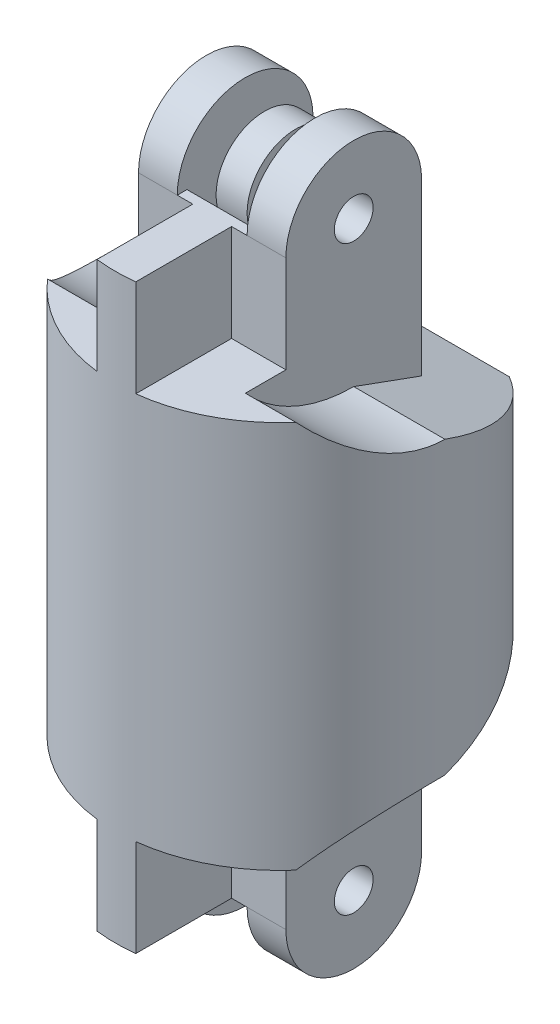
from build123d import *

# Parameters (mm, degrees)
SKETCH1_W                                 = 8.5
SKETCH1_H                                 = 10
INNER_START                               = 1.8
SKETCH2_R                                 = 1
INNER_HINGE_RIGHT_DEPTH                   = 2
SPRING_SEAT_REACH                         = 24.816
ROUNDED_START                             = -3.8
SKETCH4_R                                 = 7.5
ROUNDED_CUT_FOR_DISTAL_SEGMENT_LEFT_DEPTH = 19.262411473
SKETCH5_R                                 = 2.5
SPRING_DEPTH                              = 0.8
SPRING_WIRE_SLOT_DEPTH                    = 11
ANGLED_CUT_ROTATION_DEPTH                 = 24.786340706
CUT_EXTRUDE4_DEPTH                        = 23.06241155
CUT_EXTRUDE4_DEPTH_BACK                   = 23.06241155
STOPPER_START                             = 5
STOPPER_DEPTH                             = 5
DIGIT_FRONT_CONTOUR_DEPTH                 = 23.06241155
DIGIT_FRONT_CONTOUR_DEPTH_BACK            = 23.06241155
SKETCH10_W                                = 9.64365076
SKETCH10_H                                = 1.5
SKETCH11_R                                = 1.1
CUT_EXTRUDE5_DEPTH                        = 31.931375711


with BuildPart() as part:
    # Sketch1 → segment body (revolve)
    with BuildSketch(Plane.XY):
        with Locations((4.25, 5)):
            Rectangle(SKETCH1_W, SKETCH1_H)
    revolve(axis=Axis((0, 43.434679949, 0), (0, -1, 0)))

    # Sketch2 → inner hinge right (add)
    with BuildSketch(Plane(origin=(0, 0, 0), x_dir=(0, 0, -1), z_dir=(1, 0, 0)).offset(INNER_START)):
        with BuildLine():
            Line((-3.5, 10), (-3.5, 15))
            ThreePointArc((-3.5, 15), (0, 18.5), (3.5, 15))
            Line((3.5, 15), (3.5, 10))
            Line((3.5, 10), (-3.5, 10))
        make_face()
        with Locations((0, 15)):
            Circle(SKETCH2_R, mode=Mode.SUBTRACT)
    inner_hinge_right = extrude(amount=INNER_HINGE_RIGHT_DEPTH)

    # inner hinge left: inner hinge right across plane
    add(inner_hinge_right.mirror(Plane(origin=(0, 0, 0), x_dir=(0, 0, 1), z_dir=(1, 0, 0))))

    # Sketch3 → spring seat (add, up to next)
    with BuildSketch(Plane.ZY.offset(-1.8), mode=Mode.PRIVATE) as spring_seat_sk1:
        with BuildLine():
            Line((3.5, 10), (3.5, 15))
            Line((3.5, 15), (3, 15))
            ThreePointArc((3, 15), (0, 12), (-3, 15))
            Line((-3, 15), (-3.5, 15))
            Line((-3.5, 15), (-3.5, 10))
            Line((-3.5, 10), (3.5, 10))
        make_face()
    spring_seat_tool1 = extrude(spring_seat_sk1.sketch, amount=SPRING_SEAT_REACH, mode=Mode.PRIVATE) - part.part
    add(spring_seat_tool1.solids().sort_by_distance((1.8, 11.668717, 0))[0])

    # Sketch4 → rounded cut for distal segment left (cut, through all)
    with BuildSketch(Plane(origin=(0, 0, 0), x_dir=(0, 0, -1), z_dir=(1, 0, 0)).offset(ROUNDED_START)):
        with Locations((0, 15)):
            Circle(SKETCH4_R)
    rounded_cut_for_distal_segment_left = extrude(amount=-ROUNDED_CUT_FOR_DISTAL_SEGMENT_LEFT_DEPTH, mode=Mode.SUBTRACT)

    # round cut right: rounded cut for distal segment left across plane
    add(rounded_cut_for_distal_segment_left.mirror(Plane(origin=(0, 0, 0), x_dir=(0, 0, 1), z_dir=(1, 0, 0))), mode=Mode.SUBTRACT)


with BuildPart() as body_2:
    # Sketch5 → spring (new, symmetric)
    with BuildSketch(Plane(origin=(0, 0, 0), x_dir=(0, 0, -1), z_dir=(1, 0, 0))):
        with Locations((0, 15)):
            Circle(SKETCH5_R)
    extrude(amount=SPRING_DEPTH, both=True)


with BuildPart() as spring_wire_slot_tool:
    # Sketch6 → spring wire slot (new body)
    with BuildSketch(Plane(origin=(0, 11.801823273, 6.143640332), x_dir=(1, 0, 0), z_dir=(0, 0.8870108331782212, 0.46174861323503485))):
        with BuildLine():
            Line((-0.8, 4.926229199), (0.8, 4.926229199))
            ThreePointArc((0.8, 4.926229199), (1.3, 4.426229199), (0.8, 3.926229199))
            Line((0.8, 3.926229199), (-0.8, 3.926229199))
            ThreePointArc((-0.8, 3.926229199), (-1.3, 4.426229199), (-0.8, 4.926229199))
        make_face()
    extrude(amount=-SPRING_WIRE_SLOT_DEPTH)


with BuildPart() as part_1:
    add(part.part)

    # spring wire slot: cut by spring_wire_slot_tool
    add(spring_wire_slot_tool.part, mode=Mode.SUBTRACT)

    # Sketch7 → angled cut rotation (cut, through all)
    with BuildSketch(Plane(origin=(3.8, 0, 0), x_dir=(0, 0, -1), z_dir=(1, 0, 0))):
        Polygon((0, 7.5), (8.5, 4.406253009), (8.5, 10), (3.5, 10), align=None)
    angled_cut_rotation = extrude(amount=ANGLED_CUT_ROTATION_DEPTH, mode=Mode.SUBTRACT)

    # Mirror3: angled cut rotation across plane
    add(angled_cut_rotation.mirror(Plane(origin=(0, 0, 0), x_dir=(0, 0, 1), z_dir=(1, 0, 0))), mode=Mode.SUBTRACT)

    # Sketch8 → Cut-Extrude4 (cut, two sides: drawn at the far end of the back side and taken through both)
    with BuildSketch(Plane(origin=(0, 0, 0), x_dir=(0, 0, -1), z_dir=(1, 0, 0)).offset(-CUT_EXTRUDE4_DEPTH_BACK)):
        Polygon((3.5, 10), (3.5, 6.22610418), (7.603288762, 4.732629208), (8.5, 4.406253009), (8.5, 10), align=None)
    extrude(amount=CUT_EXTRUDE4_DEPTH + CUT_EXTRUDE4_DEPTH_BACK, mode=Mode.SUBTRACT)

    # Sketch9 → stopper (add)
    with BuildSketch(Plane(origin=(0, 10, 0), x_dir=(1, 0, 0), z_dir=(0, 1, 0)).offset(STOPPER_START)):
        with BuildLine():
            Line((-1, -3.5), (1, -3.5))
            Line((1, -3.5), (1, -8.440971508))
            ThreePointArc((1, -8.440971508), (0, -8.5), (-1, -8.440971508))
            Line((-1, -8.440971508), (-1, -3.5))
        make_face()
    extrude(amount=-STOPPER_DEPTH)

    # bottom half part mirror: part across plane


with BuildPart() as body_2_1:
    add(body_2.part)

    # spring wire slot: cut by spring_wire_slot_tool
    add(spring_wire_slot_tool.part, mode=Mode.SUBTRACT)


with BuildPart() as part_2:
    add(part_1.part)
    add(part_1.part.mirror(Plane.ZX))

    # Sketch10 → digit front contour (cut, two sides: drawn at the far end of the back side and taken through both)
    with BuildSketch(Plane(origin=(0, 0, 0), x_dir=(1, 0, 0), z_dir=(0, 1, 0)).offset(-DIGIT_FRONT_CONTOUR_DEPTH_BACK)):
        with Locations((0, 7.75)):
            Rectangle(SKETCH10_W, SKETCH10_H)
    extrude(amount=DIGIT_FRONT_CONTOUR_DEPTH + DIGIT_FRONT_CONTOUR_DEPTH_BACK, mode=Mode.SUBTRACT)

    # Sketch11 → Cut-Extrude5 (cut, through all)
    with BuildSketch(Plane(origin=(0, 10, 0), x_dir=(1, 0, 0), z_dir=(0, 1, 0))):
        with Locations(Location((0, 4.6, 0), (0, 0, 270))):
            Circle(SKETCH11_R)
    extrude(amount=-CUT_EXTRUDE5_DEPTH, mode=Mode.SUBTRACT)


solid = Compound([body_2_1.part, part_2.part])
